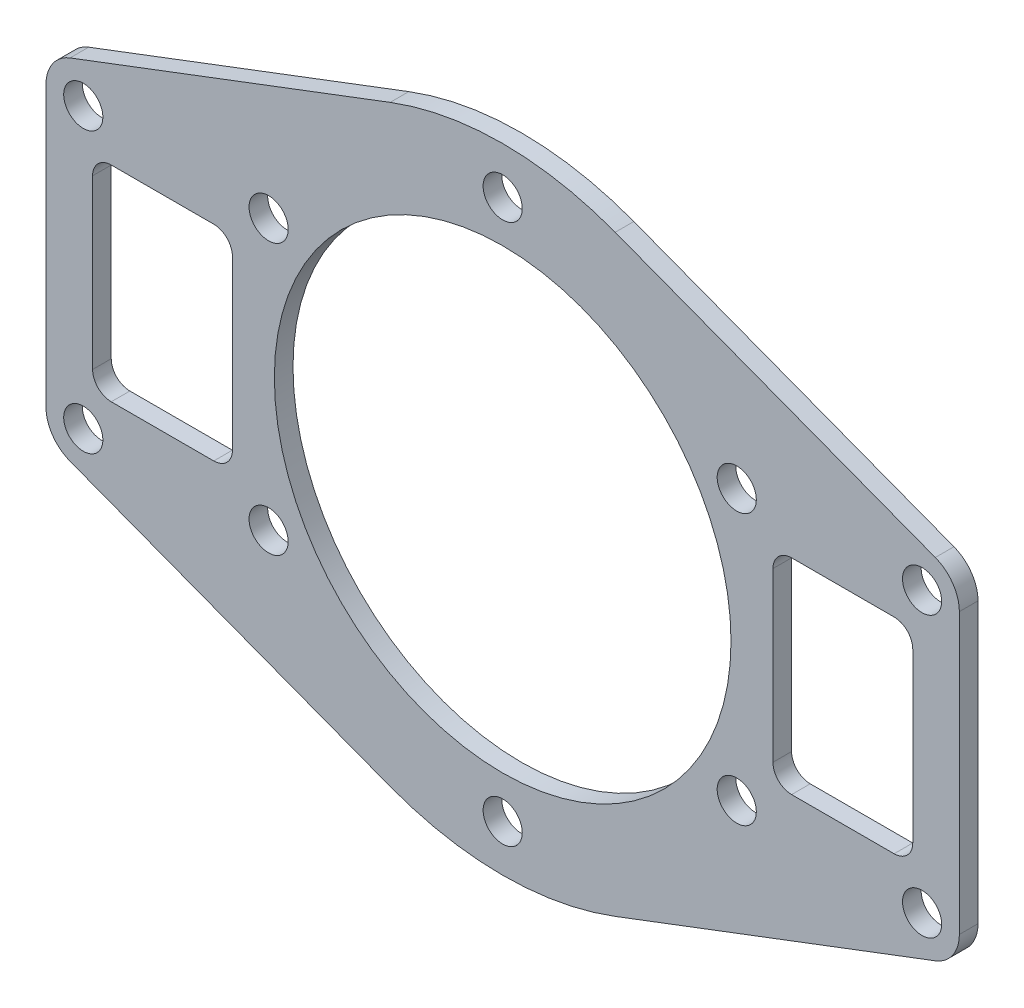
from build123d import *

# Parameters (mm, degrees)
SKETCH_1_R          = 24.5
SKETCH_1_R_2        = 2.1
EXTRUDE_1_DEPTH     = 2
CUT_EXTRUDE_1_DEPTH = 10


with BuildPart() as part:
    # 草图1 → 凸台-拉伸1 (new body)
    with BuildSketch(Plane.XY):
        with BuildLine():
            Line((-49, 15), (-49, -15))
            ThreePointArc((-49, -15), (-48.292477518, -17.271473485), (-46.420204103, -18.739387691))
            Line((-46.420204103, -18.739387691), (-12.071734875, -31.784795376))
            ThreePointArc((-12.071734875, -31.784795376), (0, -34), (12.071734875, -31.784795376))
            Line((12.071734875, -31.784795376), (46.420204103, -18.739387691))
            ThreePointArc((46.420204103, -18.739387691), (48.292477518, -17.271473485), (49, -15))
            Line((49, -15), (49, 15))
            ThreePointArc((49, 15), (48.292477518, 17.271473485), (46.420204103, 18.739387691))
            Line((46.420204103, 18.739387691), (12.071734875, 31.784795376))
            ThreePointArc((12.071734875, 31.784795376), (0, 34), (-12.071734875, 31.784795376))
            Line((-12.071734875, 31.784795376), (-46.420204103, 18.739387691))
            ThreePointArc((-46.420204103, 18.739387691), (-48.292477518, 17.271473485), (-49, 15))
        make_face()
        Circle(SKETCH_1_R, mode=Mode.SUBTRACT)
        with Locations((0, 29)):
            Circle(SKETCH_1_R_2, mode=Mode.SUBTRACT)
        with Locations((25.11473671, 14.5)):
            Circle(SKETCH_1_R_2, mode=Mode.SUBTRACT)
        with Locations((25.11473671, -14.5)):
            Circle(SKETCH_1_R_2, mode=Mode.SUBTRACT)
        with Locations((0, -29)):
            Circle(SKETCH_1_R_2, mode=Mode.SUBTRACT)
        with Locations((-25.11473671, -14.5)):
            Circle(SKETCH_1_R_2, mode=Mode.SUBTRACT)
        with Locations((-25.11473671, 14.5)):
            Circle(SKETCH_1_R_2, mode=Mode.SUBTRACT)
        with Locations((-45, 15)):
            Circle(SKETCH_1_R_2, mode=Mode.SUBTRACT)
        with Locations((-45, -15)):
            Circle(SKETCH_1_R_2, mode=Mode.SUBTRACT)
        with Locations((45, -15)):
            Circle(SKETCH_1_R_2, mode=Mode.SUBTRACT)
        with Locations((45, 15)):
            Circle(SKETCH_1_R_2, mode=Mode.SUBTRACT)
    extrude(amount=EXTRUDE_1_DEPTH)

    # 草图2 → 切除-拉伸1 (cut)
    with BuildSketch(Plane.XY.offset(2)):
        with BuildLine():
            Line((-42, 11), (-31, 11))
            ThreePointArc((-31, 11), (-29.585786438, 10.414213562), (-29, 9))
            Line((-29, 9), (-29, -9))
            ThreePointArc((-29, -9), (-29.585786438, -10.414213562), (-31, -11))
            Line((-31, -11), (-42, -11))
            ThreePointArc((-42, -11), (-43.414213562, -10.414213562), (-44, -9))
            Line((-44, -9), (-44, 9))
            ThreePointArc((-44, 9), (-43.414213562, 10.414213562), (-42, 11))
        make_face()
        with BuildLine():
            Line((31, 11), (42, 11))
            ThreePointArc((42, 11), (43.414213562, 10.414213562), (44, 9))
            Line((44, 9), (44, -9))
            ThreePointArc((44, -9), (43.414213562, -10.414213562), (42, -11))
            Line((42, -11), (31, -11))
            ThreePointArc((31, -11), (29.585786438, -10.414213562), (29, -9))
            Line((29, -9), (29, 9))
            ThreePointArc((29, 9), (29.585786438, 10.414213562), (31, 11))
        make_face()
    extrude(amount=-CUT_EXTRUDE_1_DEPTH, mode=Mode.SUBTRACT)


solid = part.part
